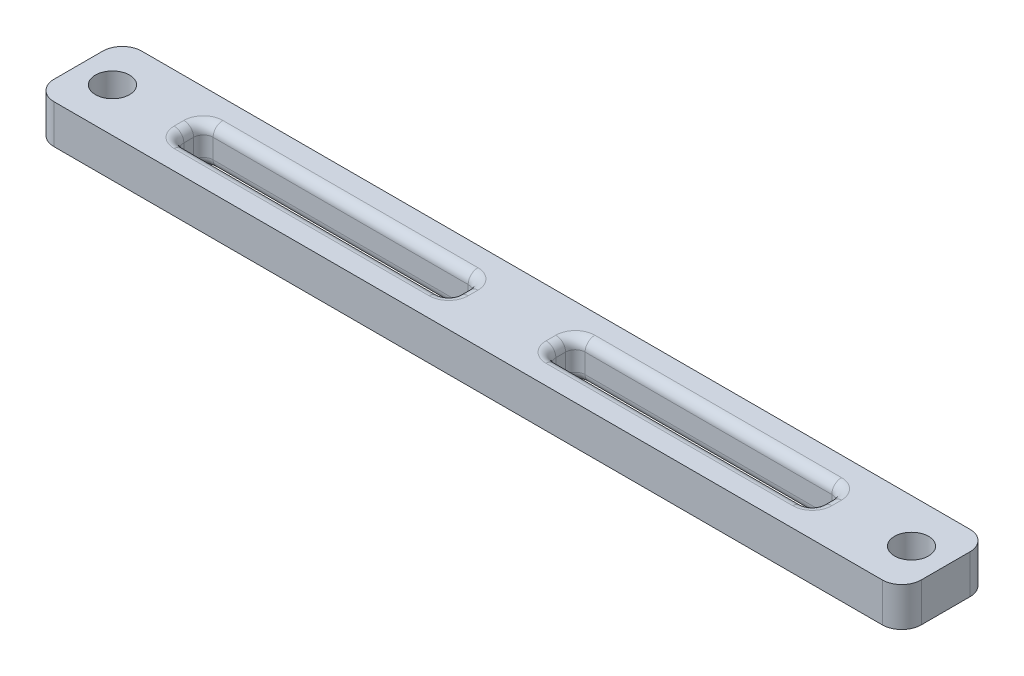
from build123d import *

# Parameters (mm, degrees)
SKETCH1_W           = 89
SKETCH1_H           = 9
BOSS_EXTRUDE1_DEPTH = 4
SKETCH2_R           = 1.75
CUT_EXTRUDE1_DEPTH  = 4
FILLET1_R           = 2
SKETCH4_W           = 28.175409777
SKETCH4_H           = 3
SKETCH4_W_2         = 27.315943202
CUT_EXTRUDE2_DEPTH  = 45.905456239
FILLET3_R           = 1


with BuildPart() as part:
    # Sketch1 → Boss-Extrude1 (new body)
    with BuildSketch(Plane(origin=(0, 0, 0), x_dir=(1, 0, 0), z_dir=(0, 1, 0))):
        Rectangle(SKETCH1_W, SKETCH1_H)
    extrude(amount=BOSS_EXTRUDE1_DEPTH)

    # Sketch2 → Cut-Extrude1 (cut)
    with BuildSketch(Plane(origin=(0, 4, 0), x_dir=(1, 0, 0), z_dir=(0, 1, 0))):
        with Locations(Location((-41, 0, 0), (0, 0, 270))):
            Circle(SKETCH2_R)
        with Locations(Location((41, 0, 0), (0, 0, 270))):
            Circle(SKETCH2_R)
    extrude(amount=-CUT_EXTRUDE1_DEPTH, mode=Mode.SUBTRACT)

    # Fillet1
    fillet1_edges = [part.edges().sort_by_distance(p)[0] for p in [
        (-44.5, 2, -4.5),
        (44.5, 2, -4.5),
        (44.5, 2, 4.5),
        (-44.5, 2, 4.5),
    ]]
    fillet(fillet1_edges, radius=FILLET1_R)

    # Sketch4 → Cut-Extrude2 (cut, through all)
    with BuildSketch(Plane(origin=(0, 4, 0), x_dir=(1, 0, 0), z_dir=(0, 1, 0))):
        with Locations((-19.087704888, 0)):
            Rectangle(SKETCH4_W, SKETCH4_H)
        with Locations((18.657971601, 0)):
            Rectangle(SKETCH4_W_2, SKETCH4_H)
    extrude(amount=-CUT_EXTRUDE2_DEPTH, mode=Mode.SUBTRACT)

    # Fillet3
    fillet3_edges = [part.edges().sort_by_distance(p)[0] for p in [
        (-33.175409777, 0, 0),
        (-33.175409777, 2, 1.5),
        (-19.087704888, 0, -1.5),
        (-33.175409777, 2, -1.5),
        (-5, 0, 0),
        (-5, 2, -1.5),
        (-19.087704888, 0, 1.5),
        (-5, 2, 1.5),
        (-33.175409777, 4, 0),
        (-19.087704888, 4, 1.5),
        (-5, 4, 0),
        (-19.087704888, 4, -1.5),
        (18.657971601, 0, 1.5),
        (32.315943202, 2, 1.5),
        (5, 0, 0),
        (5, 2, 1.5),
        (18.657971601, 0, -1.5),
        (5, 2, -1.5),
        (32.315943202, 0, 0),
        (32.315943202, 2, -1.5),
        (18.657971601, 4, 1.5),
        (32.315943202, 4, 0),
        (18.657971601, 4, -1.5),
        (5, 4, 0),
    ]]
    fillet(fillet3_edges, radius=FILLET3_R)


solid = part.part
